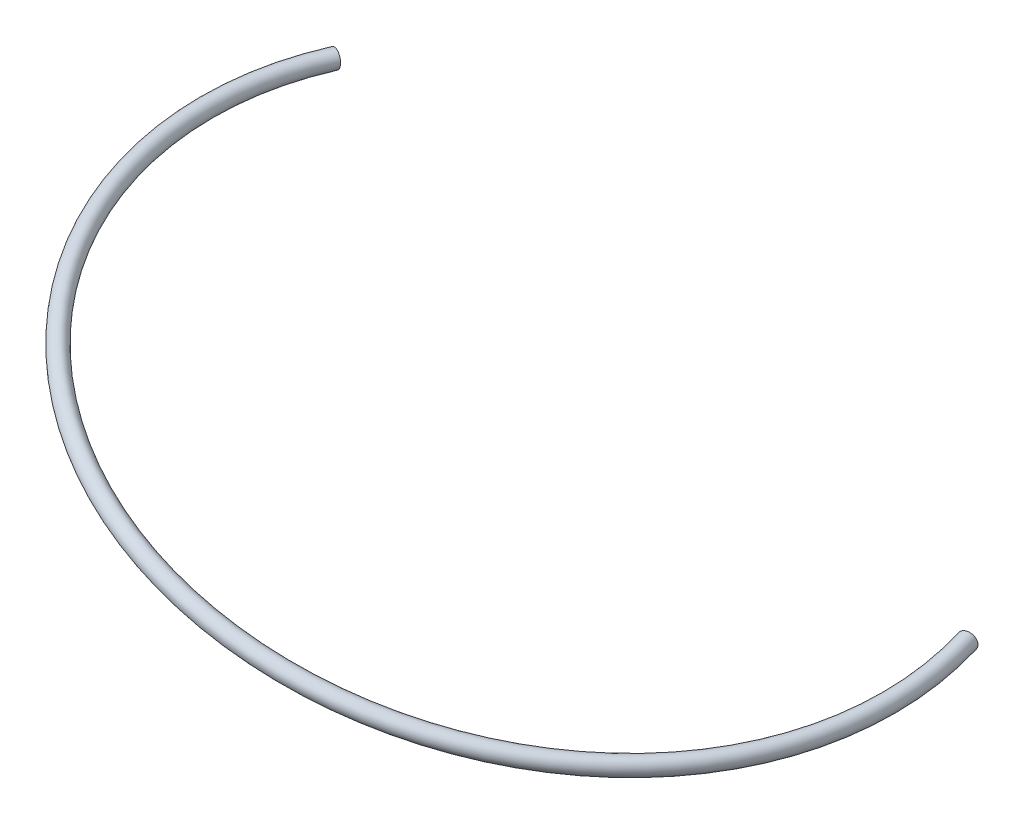
from build123d import *

# Parameters (mm, degrees)
SWEEP1_PROFILE_R = 2


with BuildPart() as part:
    # Sweep1: sweep along a path in Sketch2
    with BuildLine(Plane(origin=(11.724856878, 45.638367361, 0), x_dir=(0.96854779826277, -0.24882757580368894, 0), z_dir=(0.24882757580368894, 0.96854779826277, 0))) as sweep1_path:
        ThreePointArc((79.526424261, -22.25), (154.808376464, -129.889029759), (236.462406432, -27))
    # Sweep1 profile (on start of the path) → Sweep1 (sweep)
    with BuildSketch(Plane(origin=(88.75, 25.85, 22.25), x_dir=(0.9521858672073829, 0, 0.3055193517447368), z_dir=(-0.30458256650014326, 0.07824966593309507, 0.9492662692656602))):
        Circle(SWEEP1_PROFILE_R)
    sweep(path=sweep1_path.line)


solid = part.part
